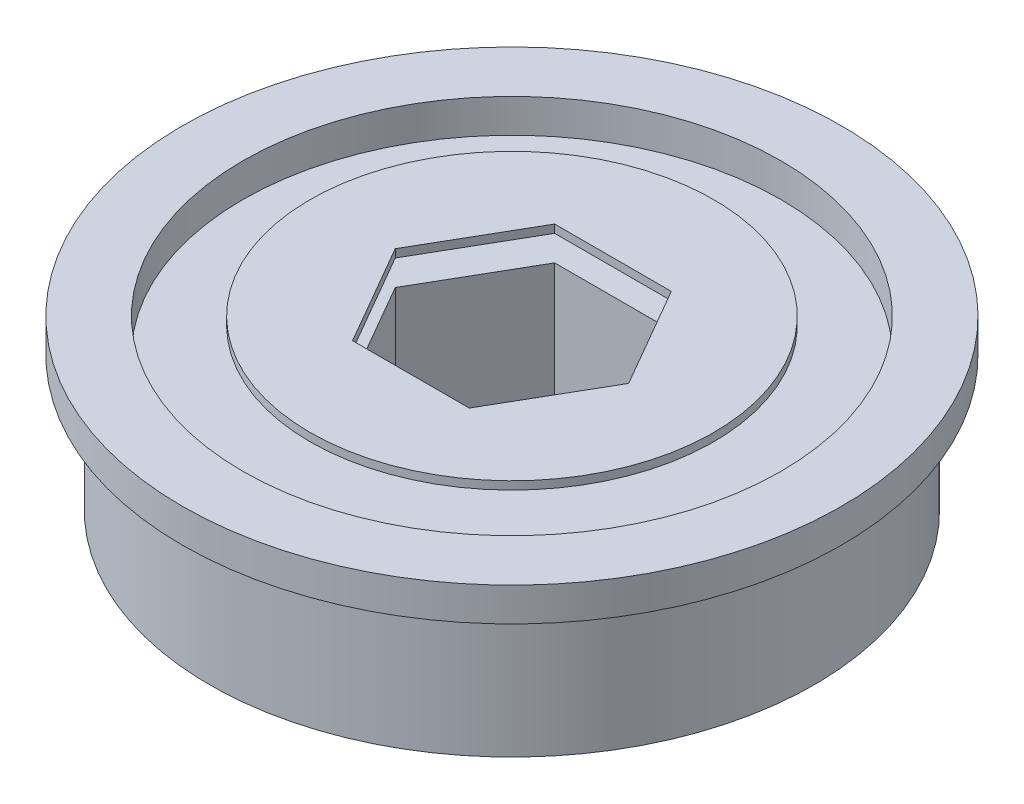
from build123d import *

# Parameters (mm, degrees)
SKETCH1_W              = 15.5575
SKETCH1_H              = 1.5875
F_1_1_DIAMETER_HOLE1_D = 25.4
SKETCH4_R              = 9.525
BOSS_EXTRUDE1_DEPTH    = 0.381
SKETCH5_R              = 14.2748
BOSS_EXTRUDE2_DEPTH    = 6.35
CUT_EXTRUDE1_DEPTH     = 24.389645546


with BuildPart() as part:
    # Sketch1 → Revolve1 (revolve)
    with BuildSketch(Plane(origin=(0, 0, 0), x_dir=(-1, 0, 0), z_dir=(0, 0, -1)), mode=Mode.PRIVATE) as revolve1_sk:
        with Locations((-7.77875, 7.14375)):
            Rectangle(SKETCH1_W, SKETCH1_H)
    revolve(revolve1_sk.sketch.rotate(Axis((0, 6.35, 0), (0, 1, 0)), 270), axis=Axis((0, 6.35, 0), (0, 1, 0)))

    # 1 (1) Diameter Hole1 (through all)
    with Locations(Plane(origin=(0, 7.9375, 0), x_dir=(1, 0, 0), z_dir=(0, 1, 0))):
        with Locations((0, 0)):
            Hole(F_1_1_DIAMETER_HOLE1_D / 2)

    # Sketch5 → Boss-Extrude2 (add)
    with BuildSketch(Plane.XZ.offset(-6.35)):
        with Locations(Location((0, 0, 0), (0, 0, 270))):
            Circle(SKETCH5_R)
    extrude(amount=BOSS_EXTRUDE2_DEPTH)


with BuildPart() as body_2:
    # Sketch4 → Boss-Extrude1 (new body)
    with BuildSketch(Plane.XZ.offset(-7.5565)):
        with Locations(Location((0, 0, 0), (0, 0, 90))):
            Circle(SKETCH4_R)
    extrude(amount=-BOSS_EXTRUDE1_DEPTH)


with BuildPart() as cut_extrude1_tool:
    # Sketch6 → Cut-Extrude1 (new, through all)
    with BuildSketch(Plane.XZ):
        Polygon((-5.507921568, 0), (-2.753960784, -4.77), (2.753960784, -4.77), (5.507921568, 0), (2.753960784, 4.77), (-2.753960784, 4.77), align=None)
    extrude(amount=-CUT_EXTRUDE1_DEPTH)


with BuildPart() as part_1:
    add(part.part)

    # Cut-Extrude1: cut by cut_extrude1_tool
    add(cut_extrude1_tool.part, mode=Mode.SUBTRACT)


with BuildPart() as body_2_1:
    add(body_2.part)

    # Cut-Extrude1: cut by cut_extrude1_tool
    add(cut_extrude1_tool.part, mode=Mode.SUBTRACT)


solid = Compound([part_1.part, body_2_1.part])
